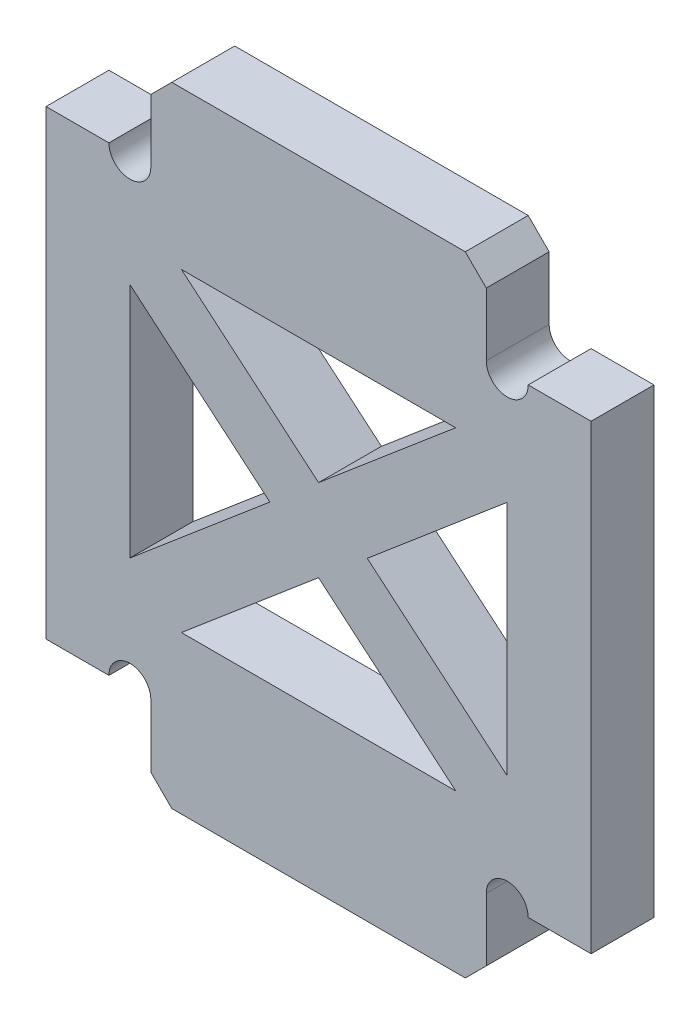
from build123d import *

# Parameters (mm, degrees)
EXTRUDE_1_DEPTH = 1.5
CHAMFER_1_SIZE  = 1


with BuildPart() as part:
    # 草图1 → 凸台-拉伸1 (new, symmetric)
    with BuildSketch(Plane.XY):
        with BuildLine():
            Line((-8, 15), (-8, 11))
            ThreePointArc((-8, 11), (-9, 10), (-10, 11))
            Line((-10, 11), (-13, 11))
            Line((-13, 11), (-13, -11))
            Line((-13, -11), (-10, -11))
            ThreePointArc((-10, -11), (-9, -10), (-8, -11))
            Line((-8, -11), (-8, -15))
            Line((-8, -15), (8, -15))
            Line((8, -15), (8, -11))
            ThreePointArc((8, -11), (9, -10), (10, -11))
            Line((10, -11), (13, -11))
            Line((13, -11), (13, 11))
            Line((13, 11), (10, 11))
            ThreePointArc((10, 11), (9, 10), (8, 11))
            Line((8, 11), (8, 15))
            Line((8, 15), (-8, 15))
        make_face()
        Polygon((2.32218905, 0), (9, 5.650455419), (9, -5.650455419), align=None, mode=Mode.SUBTRACT)
        Polygon((0, -1.964929196), (6.541447314, -7.5), (-6.541447314, -7.5), align=None, mode=Mode.SUBTRACT)
        Polygon((-9, 5.650455419), (-2.32218905, 0), (-9, -5.650455419), align=None, mode=Mode.SUBTRACT)
        Polygon((-6.541447314, 7.5), (6.541447314, 7.5), (0, 1.964929196), align=None, mode=Mode.SUBTRACT)
    extrude(amount=EXTRUDE_1_DEPTH, both=True)

    # 倒角1
    chamfer_1_edges = [part.edges().sort_by_distance(p)[0] for p in [
        (-8, 15, 0),
        (8, 15, 0),
        (8, -15, 0),
        (-8, -15, 0),
    ]]
    chamfer(chamfer_1_edges, length=CHAMFER_1_SIZE)


solid = part.part
